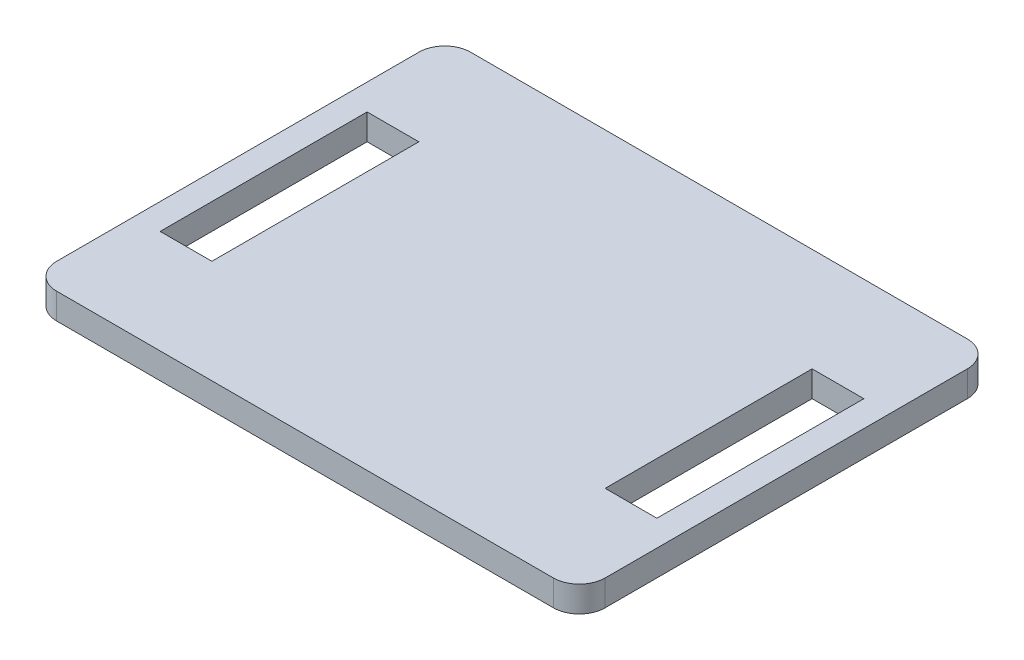
from build123d import *

# Parameters (mm, degrees)
SKETCH1_W           = 53
SKETCH1_H           = 40
SKETCH1_W_2         = 5
SKETCH1_H_2         = 20
BOSS_EXTRUDE1_DEPTH = 2.5
FILLET1_R           = 2.5


with BuildPart() as part:
    # Sketch1 → Boss-Extrude1 (new body)
    with BuildSketch(Plane(origin=(0, 0, 0), x_dir=(1, 0, 0), z_dir=(0, 1, 0))):
        Rectangle(SKETCH1_W, SKETCH1_H)
        with Locations((-21.5, 0)):
            Rectangle(SKETCH1_W_2, SKETCH1_H_2, mode=Mode.SUBTRACT)
        with Locations((21.5, 0)):
            Rectangle(SKETCH1_W_2, SKETCH1_H_2, mode=Mode.SUBTRACT)
    extrude(amount=BOSS_EXTRUDE1_DEPTH)

    # Fillet1
    fillet1_edges = [part.edges().sort_by_distance(p)[0] for p in [
        (26.5, 1.25, 20),
        (-26.5, 1.25, 20),
        (-26.5, 1.25, -20),
        (26.5, 1.25, -20),
    ]]
    fillet(fillet1_edges, radius=FILLET1_R)


solid = part.part
